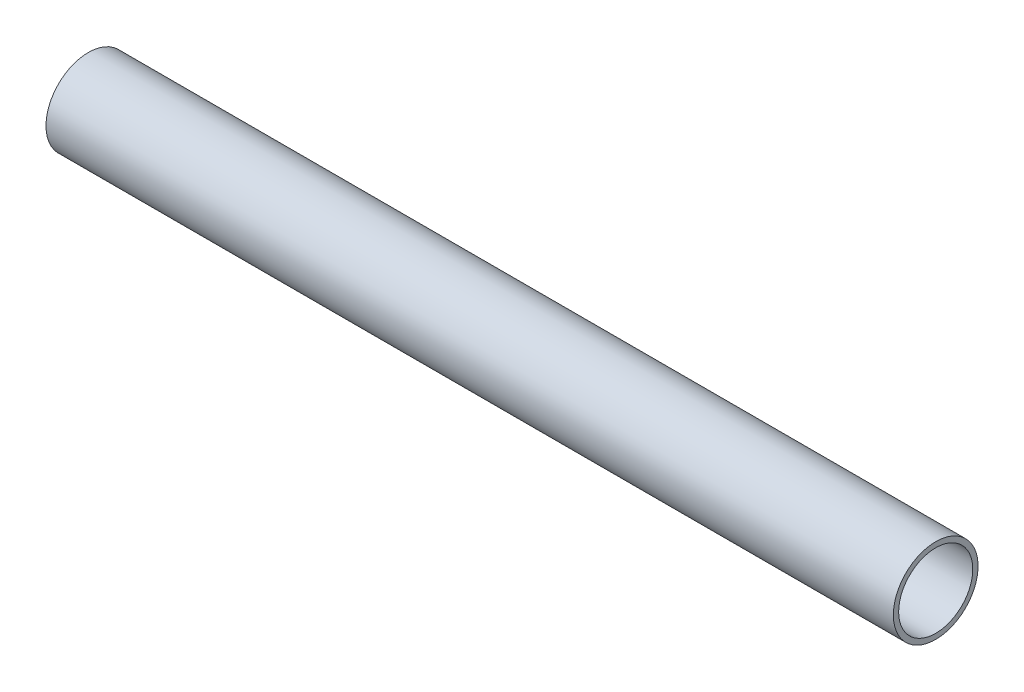
from build123d import *

# Parameters (mm, degrees)
ESQUISSE1_W = 160
ESQUISSE1_H = 1


with BuildPart() as part:
    # Esquisse1 → Base-Révolution (revolve)
    with BuildSketch(Plane.XY, mode=Mode.PRIVATE) as base_r_volution_sk:
        with Locations((80, 7.5)):
            Rectangle(ESQUISSE1_W, ESQUISSE1_H)
    revolve(base_r_volution_sk.sketch.rotate(Axis((0, 0, 0), (1, 0, 0)), 90), axis=Axis((0, 0, 0), (1, 0, 0)))


solid = part.part
